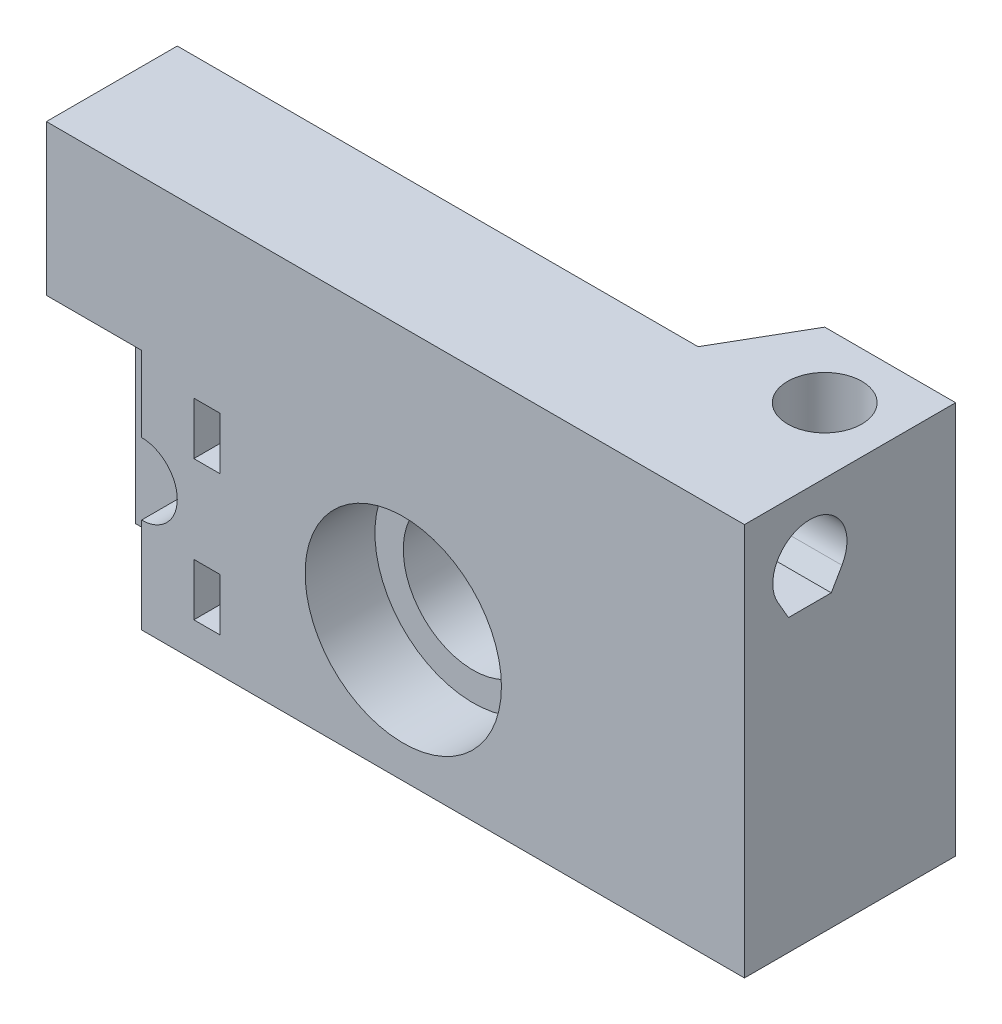
from build123d import *

# Parameters (mm, degrees)
SCHIZZO2_W                   = 80
SCHIZZO2_H                   = 30
ESTRUSIONE_ESTRUSIONE1_DEPTH = 12.1
SCHIZZO3_R                   = 4.25
TAGLIO_ESTRUSIONE1_DEPTH     = 52.443269725
SCHIZZO4_R                   = 11.25
TAGLIO_ESTRUSIONE2_DEPTH     = 8
SCHIZZO5_R                   = 8
TAGLIO_ESTRUSIONE3_DEPTH     = 46.688510591
SCHIZZO6_W                   = 80
SCHIZZO6_H                   = 24.2
SCHIZZO6_R                   = 4.25
ESTRUSIONE_ESTRUSIONE2_DEPTH = 15
TAGLIO_ESTRUSIONE4_DEPTH     = 87.292583691
TAGLIO_ESTRUSIONE5_DEPTH     = 62.411806682
SCHIZZO8_R                   = 4.1
TAGLIO_ESTRUSIONE6_DEPTH     = 12
SCHIZZO10_W                  = 10.2
SCHIZZO10_H                  = 27.75
TAGLIO_ESTRUSIONE7_DEPTH     = 10.9
TAGLIO_ESTRUSIONE8_DEPTH     = 12
SCHIZZO12_W                  = 3
SCHIZZO12_H                  = 6
TAGLIO_ESTRUSIONE9_DEPTH     = 8.2


with BuildPart() as part:
    # Schizzo2 → Estrusione-Estrusione1 (new, symmetric)
    with BuildSketch(Plane.XY):
        Rectangle(SCHIZZO2_W, SCHIZZO2_H)
    extrude(amount=ESTRUSIONE_ESTRUSIONE1_DEPTH, both=True)

    # Schizzo3 → Taglio-Estrusione1 (cut, through all)
    with BuildSketch(Plane.XZ.offset(15)):
        with Locations(Location((32.5, -4.6, 0), (0, 0, 270))):
            Circle(SCHIZZO3_R)
    extrude(amount=-TAGLIO_ESTRUSIONE1_DEPTH, mode=Mode.SUBTRACT)

    # Schizzo4 → Taglio-Estrusione2 (cut)
    with BuildSketch(Plane.XY.offset(12.1)):
        with Locations((0.9, 0)):
            Circle(SCHIZZO4_R)
    extrude(amount=-TAGLIO_ESTRUSIONE2_DEPTH, mode=Mode.SUBTRACT)

    # Schizzo5 → Taglio-Estrusione3 (cut, through all)
    with BuildSketch(Plane.XY.offset(4.1)):
        with Locations((0.9, 0)):
            Circle(SCHIZZO5_R)
    extrude(amount=-TAGLIO_ESTRUSIONE3_DEPTH, mode=Mode.SUBTRACT)

    # Schizzo6 → Estrusione-Estrusione2 (add)
    with BuildSketch(Plane(origin=(0, 15, 0), x_dir=(1, 0, 0), z_dir=(0, 1, 0))):
        Rectangle(SCHIZZO6_W, SCHIZZO6_H)
        with Locations(Location((32.5, 4.6, 0), (0, 0, 90))):
            Circle(SCHIZZO6_R, mode=Mode.SUBTRACT)
    extrude(amount=ESTRUSIONE_ESTRUSIONE2_DEPTH)

    # Schizzo7 → Taglio-Estrusione4 (cut, through all)
    with BuildSketch(Plane(origin=(40, 0, 0), x_dir=(0, 0, -1), z_dir=(1, 0, 0))):
        with BuildLine():
            Line((-2.146261356, 18.25), (-7.053738644, 18.25))
            Line((-7.053738644, 18.25), (-8.280607966, 20.375))
            ThreePointArc((-8.280607966, 20.375), (-4.6, 26.75), (-0.919392034, 20.375))
            Line((-0.919392034, 20.375), (-2.146261356, 18.25))
        make_face()
    extrude(amount=-TAGLIO_ESTRUSIONE4_DEPTH, mode=Mode.SUBTRACT)

    # Schizzo9 → Taglio-Estrusione5 (cut, through all)
    with BuildSketch(Plane.XZ.offset(15)):
        Polygon((25, -12.1), (19.688377523, -2.9), (-40, -2.9), (-40, -12.1), align=None)
    extrude(amount=-TAGLIO_ESTRUSIONE5_DEPTH, mode=Mode.SUBTRACT)

    # Schizzo8 → Taglio-Estrusione6 (cut)
    with BuildSketch(Plane.XY.offset(12.1)):
        with Locations((-29.1, 0)):
            Circle(SCHIZZO8_R)
    extrude(amount=-TAGLIO_ESTRUSIONE6_DEPTH, mode=Mode.SUBTRACT)

    # Schizzo10 → Taglio-Estrusione7 (cut)
    with BuildSketch(Plane.ZY.offset(40)):
        with Locations((7, -1.125)):
            Rectangle(SCHIZZO10_W, SCHIZZO10_H)
    extrude(amount=-TAGLIO_ESTRUSIONE7_DEPTH, mode=Mode.SUBTRACT)

    # Schizzo11 → Taglio-Estrusione8 (cut)
    with BuildSketch(Plane.ZY.offset(29.1)):
        with BuildLine():
            Line((8.110362971, 6.25), (6.089637029, 6.25))
            Line((6.089637029, 6.25), (5.584455543, 7.125))
            ThreePointArc((5.584455543, 7.125), (7.1, 9.75), (8.615544457, 7.125))
            Line((8.615544457, 7.125), (8.110362971, 6.25))
        make_face()
        with BuildLine():
            Line((8.110362971, -9.75), (6.089637029, -9.75))
            Line((6.089637029, -9.75), (5.584455543, -8.875))
            ThreePointArc((5.584455543, -8.875), (7.1, -6.25), (8.615544457, -8.875))
            Line((8.615544457, -8.875), (8.110362971, -9.75))
        make_face()
    extrude(amount=-TAGLIO_ESTRUSIONE8_DEPTH, mode=Mode.SUBTRACT)

    # Schizzo12 → Taglio-Estrusione9 (cut)
    with BuildSketch(Plane.XY.offset(12.1)):
        with Locations((-21.6, -8)):
            Rectangle(SCHIZZO12_W, SCHIZZO12_H)
        with Locations((-21.6, 8)):
            Rectangle(SCHIZZO12_W, SCHIZZO12_H)
    extrude(amount=-TAGLIO_ESTRUSIONE9_DEPTH, mode=Mode.SUBTRACT)


solid = part.part
